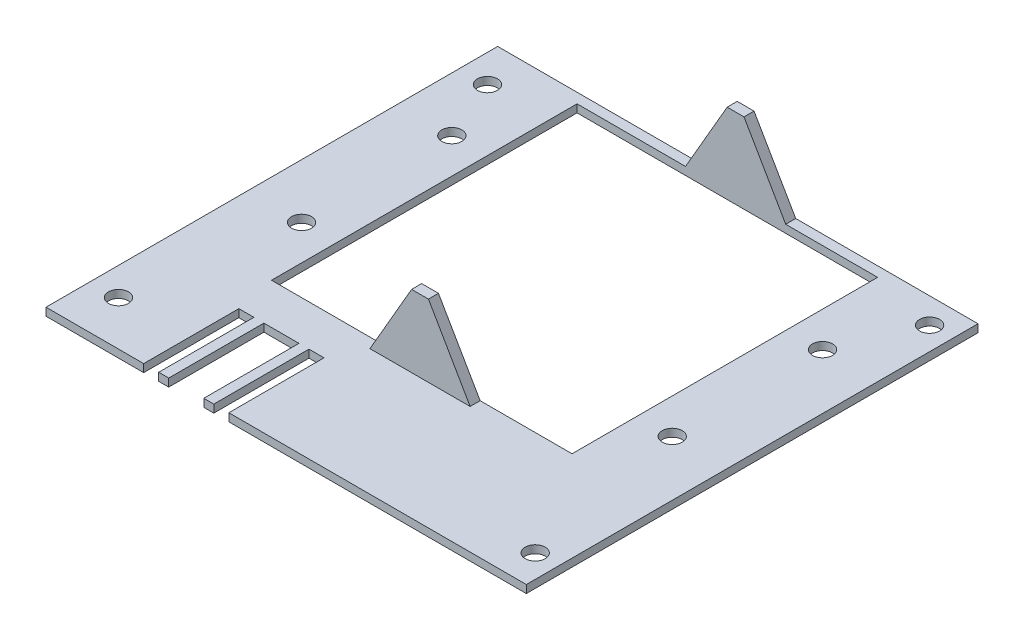
from build123d import *

# Parameters (mm, degrees)
SKETCH1_W               = 96.89
SKETCH1_H               = 90.17
PCB_DEPTH               = 1.57
SKETCH2_R               = 2
M3_MOUNTING_HOLES_DEPTH = 1.57
SKETCH4_R               = 2
CUT_EXTRUDE1_DEPTH      = 23
BOSS_EXTRUDE2_DEPTH     = 2
BOSS_EXTRUDE3_DEPTH     = 2
SKETCH9_W               = 3
SKETCH9_H               = 19
SKETCH9_W_2             = 7
CUT_EXTRUDE2_DEPTH      = 128.304608561
SKETCH10_W              = 0.5
SKETCH10_H              = 90.17
CUT_EXTRUDE3_DEPTH      = 10
SKETCH11_W              = 60
SKETCH11_H              = 61
CUT_EXTRUDE4_DEPTH      = 10


with BuildPart() as part:
    # Sketch1 → PCB (new body)
    with BuildSketch(Plane(origin=(0, 0, 0), x_dir=(1, 0, 0), z_dir=(0, 1, 0))):
        with Locations((16.200949951, 63.633996534)):
            Rectangle(SKETCH1_W, SKETCH1_H)
    extrude(amount=PCB_DEPTH)

    # Sketch2 → M3 Mounting Holes (cut)
    with BuildSketch(Plane(origin=(0, 1.57, 0), x_dir=(1, 0, 0), z_dir=(0, 1, 0))):
        with Locations(Location((59.565949951, 24.898996534, 0), (0, 0, 270))):
            Circle(SKETCH2_R)
        with Locations(Location((-26.164050049, 27.438996534, 0), (0, 0, 270))):
            Circle(SKETCH2_R)
        with Locations(Location((-26.164050049, 101.098996534, 0), (0, 0, 270))):
            Circle(SKETCH2_R)
        with Locations(Location((59.565949951, 103.638996534, 0), (0, 0, 270))):
            Circle(SKETCH2_R)
    extrude(amount=-M3_MOUNTING_HOLES_DEPTH, mode=Mode.SUBTRACT)

    # Sketch4 → Cut-Extrude1 (cut)
    with BuildSketch(Plane(origin=(0, 1.57, 0), x_dir=(1, 0, 0), z_dir=(0, 1, 0))):
        with Locations(Location((-20.894050049, 88.718996534, 0), (0, 0, 270))):
            Circle(SKETCH4_R)
        with Locations(Location((53.105949951, 88.718996534, 0), (0, 0, 270))):
            Circle(SKETCH4_R)
        with Locations(Location((-20.894050049, 58.718996534, 0), (0, 0, 270))):
            Circle(SKETCH4_R)
        with Locations(Location((53.105949951, 58.718996534, 0), (0, 0, 270))):
            Circle(SKETCH4_R)
    extrude(amount=-CUT_EXTRUDE1_DEPTH, mode=Mode.SUBTRACT)

    # Sketch7 → Boss-Extrude2 (add)
    with BuildSketch(Plane.XY.offset(-45.718996534)):
        Polygon((27.755949951, 1.57), (19.438412086, 15.976398176), (16.073487816, 15.976398176), (7.755949951, 1.57), align=None)
    extrude(amount=BOSS_EXTRUDE2_DEPTH)

    # Sketch8 → Boss-Extrude3 (add)
    with BuildSketch(Plane.XY.offset(-108.718996534)):
        Polygon((27.755949951, 1.57), (19.438412086, 15.976398176), (16.073487816, 15.976398176), (7.755949951, 1.57), align=None)
    extrude(amount=BOSS_EXTRUDE3_DEPTH)

    # Sketch9 → Cut-Extrude2 (cut, through all)
    with BuildSketch(Plane(origin=(0, 1.57, 0), x_dir=(1, 0, 0), z_dir=(0, 1, 0))):
        with Locations((-10.744050049, 28.048996534)):
            Rectangle(SKETCH9_W, SKETCH9_H)
        with Locations((-3.744050049, 28.048996534)):
            Rectangle(SKETCH9_W_2, SKETCH9_H)
        with Locations((3.255949951, 28.048996534)):
            Rectangle(SKETCH9_W, SKETCH9_H)
    extrude(amount=-CUT_EXTRUDE2_DEPTH, mode=Mode.SUBTRACT)

    # Sketch10 → Cut-Extrude3 (cut)
    with BuildSketch(Plane(origin=(0, 1.57, 0), x_dir=(1, 0, 0), z_dir=(0, 1, 0))):
        with Locations((-31.994050049, 63.633996534)):
            Rectangle(SKETCH10_W, SKETCH10_H)
        with Locations((64.395949951, 63.633996534)):
            Rectangle(SKETCH10_W, SKETCH10_H)
    extrude(amount=-CUT_EXTRUDE3_DEPTH, mode=Mode.SUBTRACT)

    # Sketch11 → Cut-Extrude4 (cut)
    with BuildSketch(Plane(origin=(0, 1.57, 0), x_dir=(1, 0, 0), z_dir=(0, 1, 0))):
        with Locations((16.105949951, 76.218996534)):
            Rectangle(SKETCH11_W, SKETCH11_H)
    extrude(amount=-CUT_EXTRUDE4_DEPTH, mode=Mode.SUBTRACT)


solid = part.part
